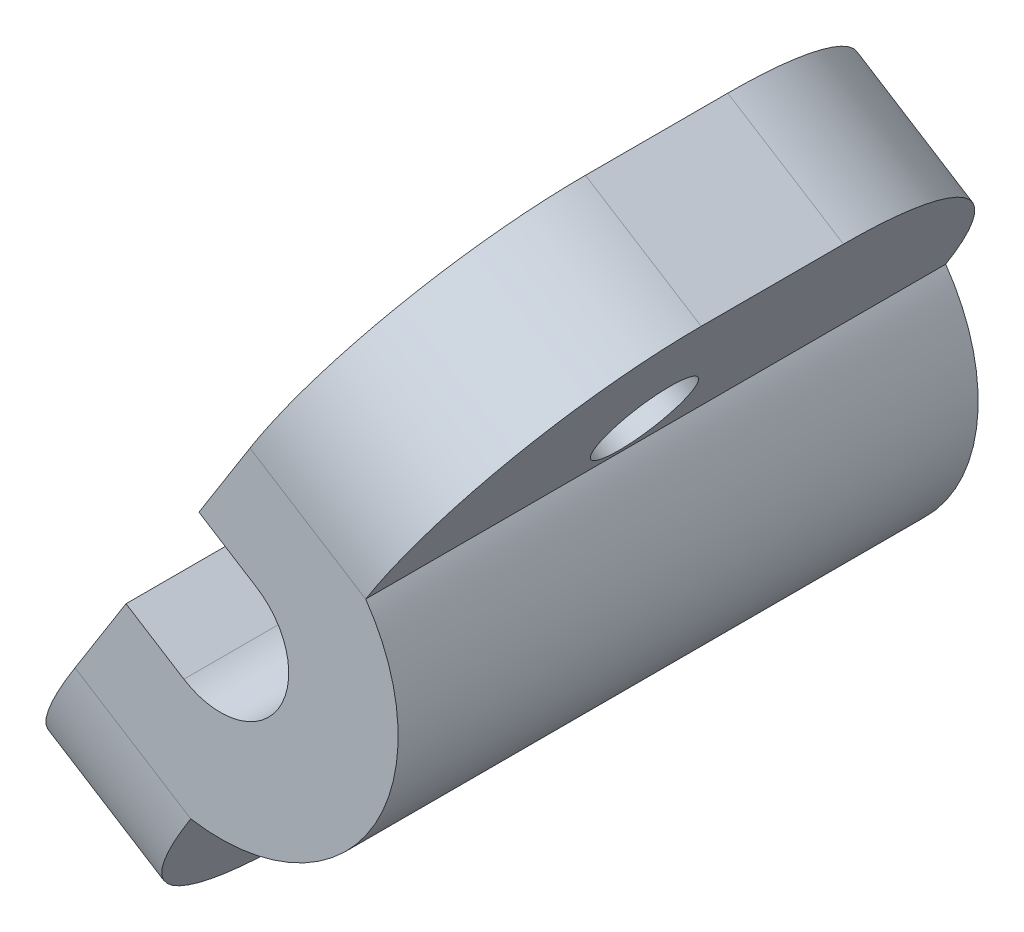
from build123d import *

# Parameters (mm, degrees)
BOSS_EXTRUDE2_DEPTH = 10
BOSS_EXTRUDE3_START = 8
BOSS_EXTRUDE3_DEPTH = 8
CUT_EXTRUDE1_REACH  = 23.149
SKETCH3_R           = 1.75
BOSS_EXTRUDE4_DEPTH = 3.204301934
FILLET2_R           = 8


with BuildPart() as part:
    # Sketch1 → Boss-Extrude2 (new body)
    with BuildSketch(Plane.XY):
        with BuildLine():
            Line((2.115260933, -1.332543126), (-1.082842756, -6.409169335))
            ThreePointArc((-1.082842756, -6.409169335), (5.499678326, -3.464612288), (5.313364545, 3.744082959))
            Line((5.313364545, 3.744082959), (2.115260933, -1.332543126))
        make_face()
        with BuildLine():
            Line((-3.447804083, -0.782717707), (-5.313364545, -3.744082959))
            ThreePointArc((-5.313364545, -3.744082959), (-3.464612288, -5.499678326), (-1.082842756, -6.409169335))
            Line((-1.082842756, -6.409169335), (2.115260933, -1.332543126))
            ThreePointArc((2.115260933, -1.332543126), (0.553465034, -2.437965639), (-1.332543188, -2.115260895))
            Line((-1.332543188, -2.115260895), (-3.447804083, -0.782717707))
        make_face()
        with BuildLine():
            Line((-5.313364545, -3.744082959), (-9.577502747, -10.512917822))
            Line((-9.577502747, -10.512917822), (-5.346980957, -13.178004198))
            Line((-5.346980957, -13.178004198), (-1.082842756, -6.409169335))
            ThreePointArc((-1.082842756, -6.409169335), (-3.464612288, -5.499678326), (-5.313364545, -3.744082959))
        make_face()
        with BuildLine():
            ThreePointArc((2.5, 0), (2.401890124, -0.693486722), (2.115260933, -1.332543126))
            Line((2.115260933, -1.332543126), (5.313364545, 3.744082959))
            ThreePointArc((5.313364545, 3.744082959), (3.464612288, 5.499678326), (1.082842756, 6.409169335))
            Line((1.082842756, 6.409169335), (-0.782717707, 3.447804083))
            Line((-0.782717707, 3.447804083), (1.332543188, 2.115260895))
            ThreePointArc((1.332543188, 2.115260895), (2.188761975, 1.208023599), (2.5, 0))
        make_face()
        with BuildLine():
            ThreePointArc((1.082842756, 6.409169335), (3.464612288, 5.499678326), (5.313364545, 3.744082959))
            Line((5.313364545, 3.744082959), (9.577502747, 10.512917822))
            Line((9.577502747, 10.512917822), (5.346980957, 13.178004198))
            Line((5.346980957, 13.178004198), (1.082842756, 6.409169335))
        make_face()
    extrude(amount=-BOSS_EXTRUDE2_DEPTH)

    # Sketch2 → Boss-Extrude3 (add)
    with BuildSketch(Plane.XY.offset(BOSS_EXTRUDE3_START)):
        with BuildLine():
            Line((5.313364545, 3.744082959), (9.577502747, 10.512917822))
            Line((9.577502747, 10.512917822), (5.346980957, 13.178004198))
            Line((5.346980957, 13.178004198), (-0.782717707, 3.447804083))
            Line((-0.782717707, 3.447804083), (1.332543188, 2.115260895))
            ThreePointArc((1.332543188, 2.115260895), (2.115260895, -1.332543188), (-1.332543188, -2.115260895))
            Line((-1.332543188, -2.115260895), (-3.447804083, -0.782717707))
            Line((-3.447804083, -0.782717707), (-9.577502747, -10.512917822))
            Line((-9.577502747, -10.512917822), (-5.346980957, -13.178004198))
            Line((-5.346980957, -13.178004198), (-1.082842756, -6.409169335))
            ThreePointArc((-1.082842756, -6.409169335), (5.499678326, -3.464612288), (5.313364545, 3.744082959))
        make_face()
    extrude(amount=-BOSS_EXTRUDE3_DEPTH)

    # Sketch3 → Cut-Extrude1 (cut, up to next)
    with BuildSketch(Plane(origin=(2.115260895, -1.332543188, 0), x_dir=(0, 0, -1), z_dir=(0.8461043578704048, -0.5330172751353468, 0)), mode=Mode.PRIVATE) as cut_extrude1_sk1:
        with Locations(Location((1.124998711, 8, 0), (0, 0, 90))):
            Circle(SKETCH3_R)
    cut_extrude1_tool1 = extrude(cut_extrude1_sk1.sketch, amount=-CUT_EXTRUDE1_REACH, mode=Mode.PRIVATE) & part.part
    # Sketch3 → Cut-Extrude1 (cut, up to next)
    with BuildSketch(Plane(origin=(2.115260895, -1.332543188, 0), x_dir=(0, 0, -1), z_dir=(0.8461043578704048, -0.5330172751353468, 0)), mode=Mode.PRIVATE) as cut_extrude1_sk2:
        with Locations(Location((1.124998711, -8, 0), (0, 0, 90))):
            Circle(SKETCH3_R)
    cut_extrude1_tool2 = extrude(cut_extrude1_sk2.sketch, amount=-CUT_EXTRUDE1_REACH, mode=Mode.PRIVATE) & part.part
    add(cut_extrude1_tool1.solids().sort_by_distance((6.379399, 5.436292, -1.124999))[0], mode=Mode.SUBTRACT)
    add(cut_extrude1_tool2.solids().sort_by_distance((-2.148877, -8.101378, -1.124999))[0], mode=Mode.SUBTRACT)

    # Sketch4 → Boss-Extrude4 (add)
    with BuildSketch(Plane(origin=(0, 0, -10), x_dir=(-1, 0, 0), z_dir=(0, 0, -1))):
        with BuildLine():
            Line((1.082842756, -6.409169335), (5.346980957, -13.178004198))
            Line((5.346980957, -13.178004198), (9.577502747, -10.512917822))
            Line((9.577502747, -10.512917822), (3.447804083, -0.782717707))
            Line((3.447804083, -0.782717707), (1.332543188, -2.115260895))
            ThreePointArc((1.332543188, -2.115260895), (-2.115260895, -1.332543188), (-1.332543188, 2.115260895))
            Line((-1.332543188, 2.115260895), (0.782717707, 3.447804083))
            Line((0.782717707, 3.447804083), (-5.346980957, 13.178004198))
            Line((-5.346980957, 13.178004198), (-9.577502747, 10.512917822))
            Line((-9.577502747, 10.512917822), (-5.313364545, 3.744082959))
            ThreePointArc((-5.313364545, 3.744082959), (-5.499678326, -3.464612288), (1.082842756, -6.409169335))
        make_face()
    extrude(amount=BOSS_EXTRUDE4_DEPTH)

    # Fillet2
    fillet2_edges = [part.edges().sort_by_distance(p)[0] for p in [
        (-7.462241852, -11.84546101, -13.204301934),
        (-7.462241852, -11.84546101, 8),
        (7.462241852, 11.84546101, 8),
        (7.462241852, 11.84546101, -13.204301934),
    ]]
    fillet(fillet2_edges, radius=FILLET2_R)


solid = part.part
